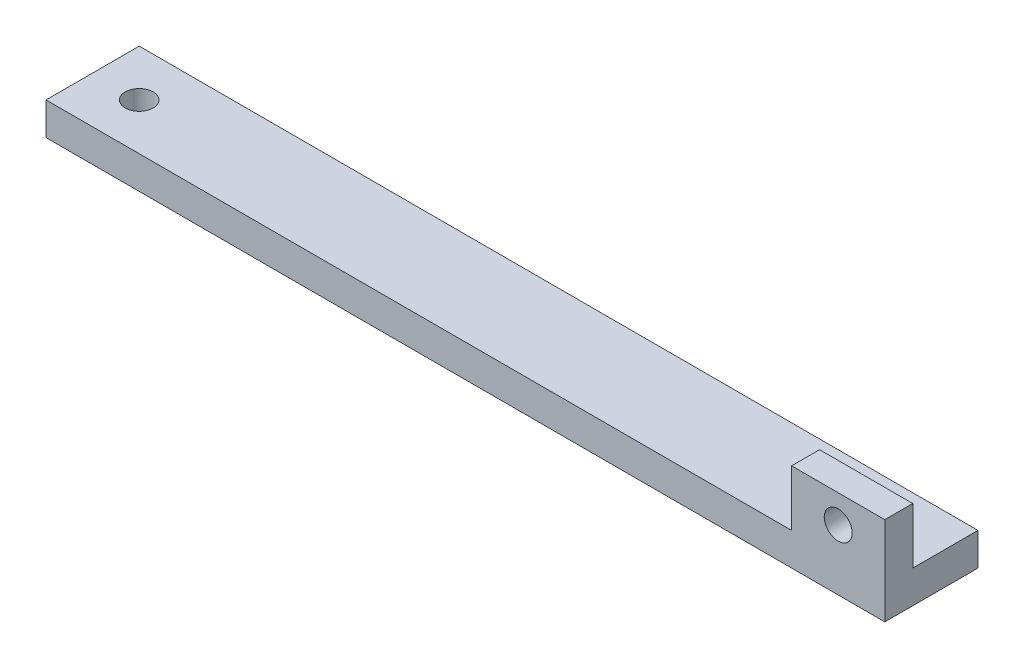
from build123d import *

# Parameters (mm, degrees)
SKETCH1_W           = 90
SKETCH1_H           = 10
SKETCH1_R           = 1.5
BOSS_EXTRUDE1_DEPTH = 3.5
SKETCH2_W           = 10
SKETCH2_H           = 3
BOSS_EXTRUDE2_DEPTH = 6
SKETCH3_R           = 1.5
CUT_EXTRUDE1_DEPTH  = 3


with BuildPart() as part:
    # Sketch1 → Boss-Extrude1 (new body)
    with BuildSketch(Plane(origin=(0, 0, 0), x_dir=(1, 0, 0), z_dir=(0, 1, 0))):
        Rectangle(SKETCH1_W, SKETCH1_H)
        with Locations(Location((-40, 0, 0), (0, 0, 270))):
            Circle(SKETCH1_R, mode=Mode.SUBTRACT)
    extrude(amount=BOSS_EXTRUDE1_DEPTH)

    # Sketch2 → Boss-Extrude2 (add)
    with BuildSketch(Plane(origin=(0, 3.5, 0), x_dir=(1, 0, 0), z_dir=(0, 1, 0))):
        with Locations((40, -3.5)):
            Rectangle(SKETCH2_W, SKETCH2_H)
    extrude(amount=BOSS_EXTRUDE2_DEPTH)

    # Sketch3 → Cut-Extrude1 (cut)
    with BuildSketch(Plane(origin=(0, 0, 2), x_dir=(-1, 0, 0), z_dir=(0, 0, -1))):
        with Locations((-40, 6.5)):
            Circle(SKETCH3_R)
    extrude(amount=-CUT_EXTRUDE1_DEPTH, mode=Mode.SUBTRACT)


solid = part.part
